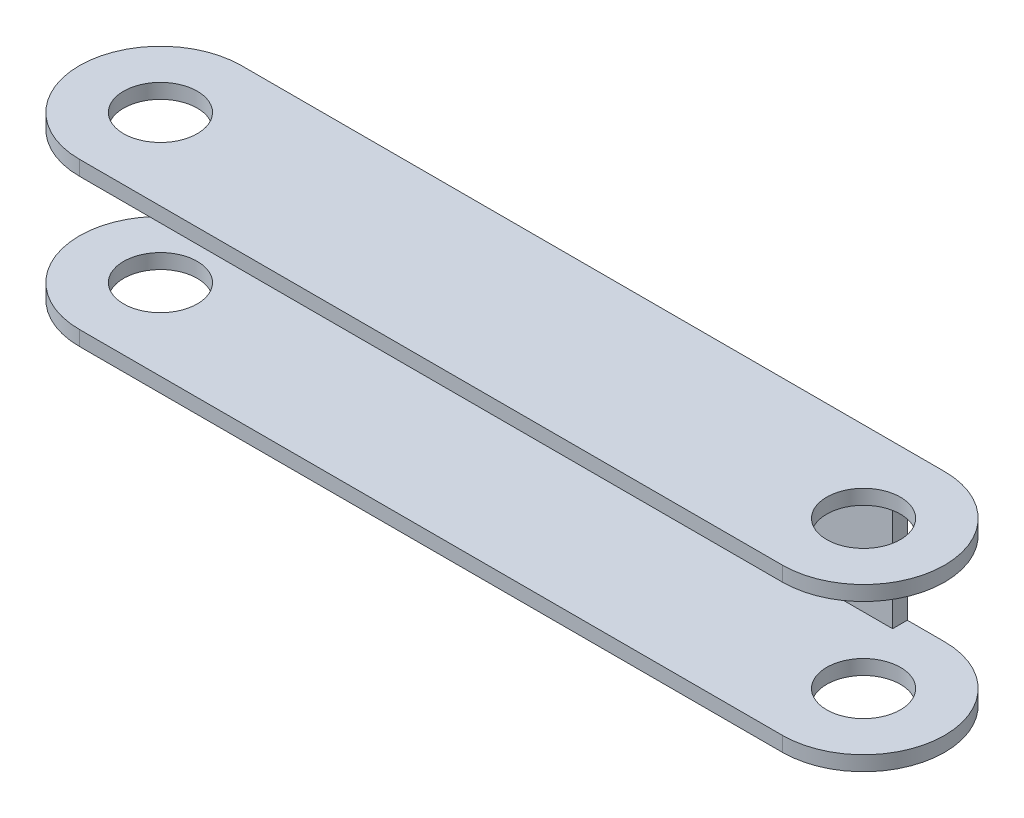
from build123d import *

# Parameters (mm, degrees)
SKETCH1_R           = 5
BOSS_EXTRUDE1_DEPTH = 2
SKETCH2_W           = 80
SKETCH2_H           = 2
BOSS_EXTRUDE2_DEPTH = 9


with BuildPart() as part:
    # Sketch1 → Boss-Extrude1 (new body)
    with BuildSketch(Plane(origin=(0, 0, 0), x_dir=(1, 0, 0), z_dir=(0, 1, 0))):
        with BuildLine():
            Line((-47.7, 11), (47.7, 11))
            ThreePointArc((47.7, 11), (58.7, 0), (47.7, -11))
            Line((47.7, -11), (-47.7, -11))
            ThreePointArc((-47.7, -11), (-58.7, 0), (-47.7, 11))
        make_face()
        with Locations(Location((47.7, 0, 0), (0, 0, 270))):
            Circle(SKETCH1_R, mode=Mode.SUBTRACT)
        with Locations(Location((-47.7, 0, 0), (0, 0, 270))):
            Circle(SKETCH1_R, mode=Mode.SUBTRACT)
    extrude(amount=BOSS_EXTRUDE1_DEPTH)

    # Sketch2 → Boss-Extrude2 (add)
    with BuildSketch(Plane(origin=(0, 2, 0), x_dir=(1, 0, 0), z_dir=(0, 1, 0))):
        with Locations((2.64092049, 10)):
            Rectangle(SKETCH2_W, SKETCH2_H)
    extrude(amount=BOSS_EXTRUDE2_DEPTH)

    # Mirror1: part across plane


with BuildPart() as part_1:
    add(part.part)
    add(part.part.mirror(Plane.ZX.offset(11)))


solid = part_1.part
